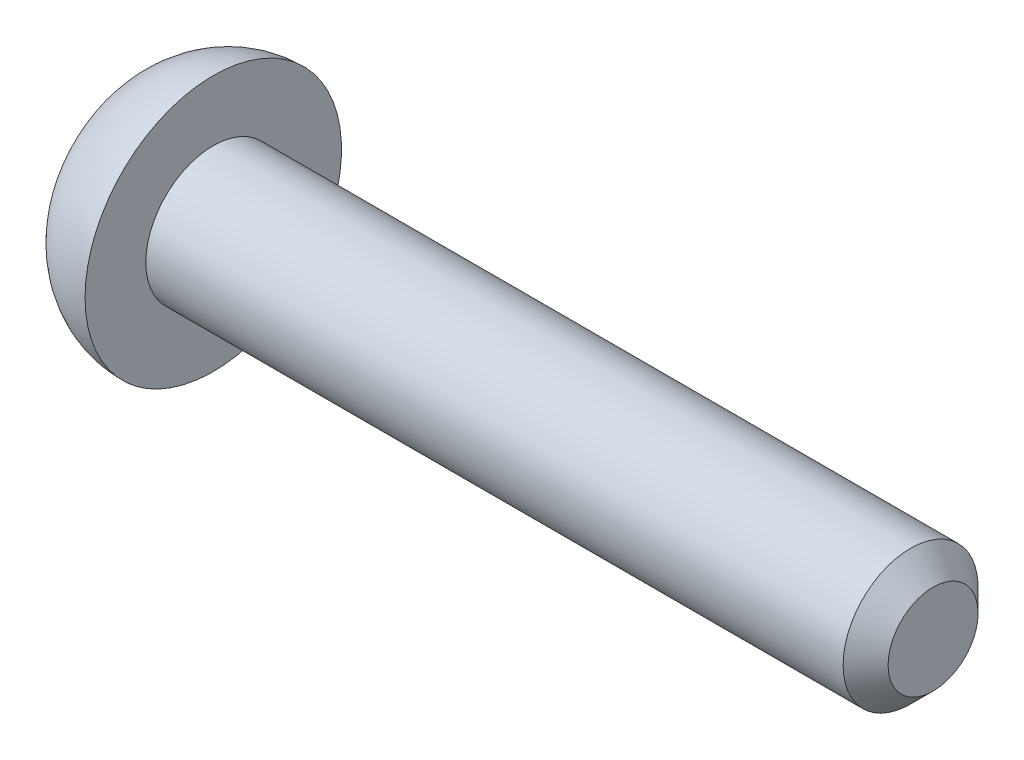
from build123d import *

# Parameters (mm, degrees)
CHAMFER1_SIZE      = 0.5
CUT_EXTRUDE1_DEPTH = 1


with BuildPart() as part:
    # Sketch2 → Revolve1 (revolve)
    with BuildSketch(Plane(origin=(0, 0, 0), x_dir=(1, 0, 0), z_dir=(0, 1, 0)), mode=Mode.PRIVATE) as revolve1_sk:
        with BuildLine():
            Line((0, 0), (0, 1.5))
            Line((0, 1.5), (-16, 1.5))
            Line((-16, 1.5), (-16, 2.85))
            ThreePointArc((-16, 2.85), (-16.917065968, 2.639177072), (-17.65, 2.049038106))
            Line((-17.65, 2.049038106), (-17.65, 0))
            Line((-17.65, 0), (0, 0))
        make_face()
    revolve(revolve1_sk.sketch.rotate(Axis((-17.65, 0, 0), (1, 0, 0)), 180), axis=Axis((-17.65, 0, 0), (1, 0, 0)))

    # Chamfer1
    chamfer1_edges = [part.edges().sort_by_distance(p)[0] for p in [
        (0, 0, -1.5),
    ]]
    chamfer(chamfer1_edges, length=CHAMFER1_SIZE)

    # Sketch4 → Cut-Extrude1 (cut)
    with BuildSketch(Plane.ZY.offset(17.65)):
        with BuildLine():
            ThreePointArc((-1.342027284, 0.090739778), (-0.883315009, 0.509982158), (-0.749596595, 1.116859832))
            ThreePointArc((-0.749596595, 1.116859832), (-0.7, 1.212435565), (-0.592430689, 1.20759961))
            ThreePointArc((-0.592430689, 1.20759961), (0, 1.019964317), (0.592430689, 1.20759961))
            ThreePointArc((0.592430689, 1.20759961), (0.7, 1.212435565), (0.749596595, 1.116859832))
            ThreePointArc((0.749596595, 1.116859832), (0.883315009, 0.509982158), (1.342027284, 0.090739778))
            ThreePointArc((1.342027284, 0.090739778), (1.4, 0), (1.342027284, -0.090739778))
            ThreePointArc((1.342027284, -0.090739778), (0.883315009, -0.509982158), (0.749596595, -1.116859832))
            ThreePointArc((0.749596595, -1.116859832), (0.7, -1.212435565), (0.592430689, -1.20759961))
            ThreePointArc((0.592430689, -1.20759961), (0, -1.019964317), (-0.592430689, -1.20759961))
            ThreePointArc((-0.592430689, -1.20759961), (-0.7, -1.212435565), (-0.749596595, -1.116859832))
            ThreePointArc((-0.749596595, -1.116859832), (-0.883315009, -0.509982158), (-1.342027284, -0.090739778))
            ThreePointArc((-1.342027284, -0.090739778), (-1.4, 0), (-1.342027284, 0.090739778))
        make_face()
    extrude(amount=-CUT_EXTRUDE1_DEPTH, mode=Mode.SUBTRACT)


solid = part.part
